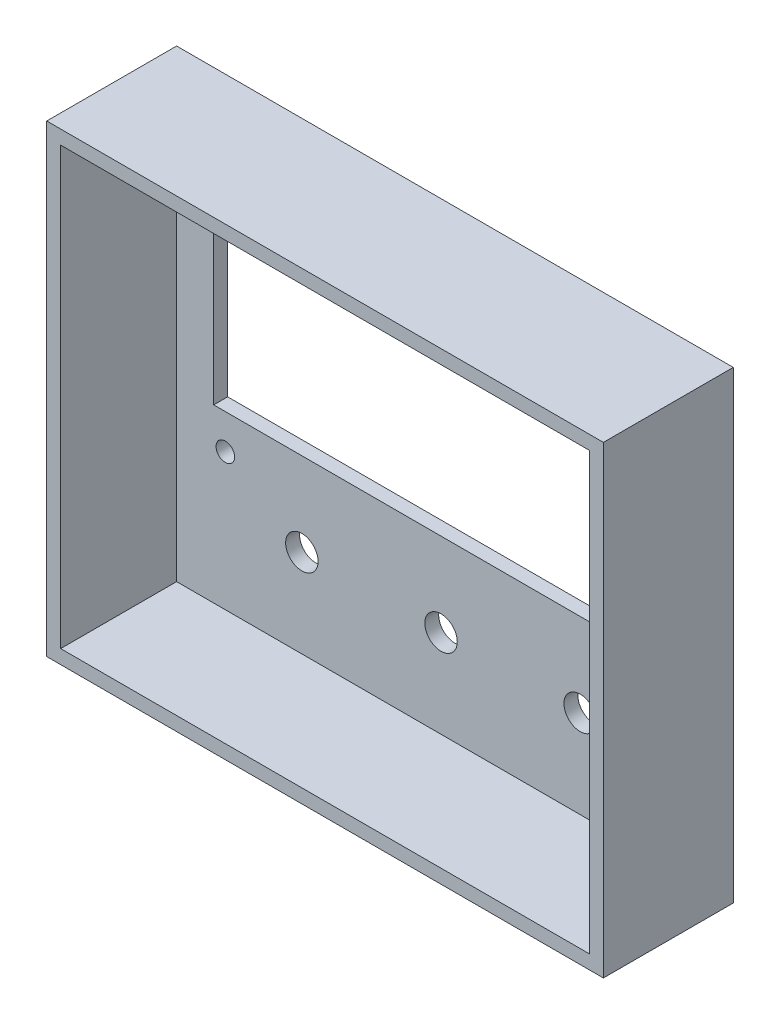
from build123d import *

# Parameters (mm, degrees)
CROQUIS1_W              = 120
CROQUIS1_H              = 100
SALIENTE_EXTRUIR1_DEPTH = 3
CROQUIS2_R              = 2
CROQUIS2_R_2            = 3.5
CORTAR_EXTRUIR1_DEPTH   = 3
CROQUIS3_W              = 120
CROQUIS3_H              = 100
CROQUIS3_W_2            = 114
CROQUIS3_H_2            = 94
SALIENTE_EXTRUIR2_DEPTH = 25


with BuildPart() as part:
    # Croquis1 → Saliente-Extruir1 (new body)
    with BuildSketch(Plane.XY):
        with Locations((60, 50)):
            Rectangle(CROQUIS1_W, CROQUIS1_H)
    extrude(amount=SALIENTE_EXTRUIR1_DEPTH)

    # Croquis2 → Cortar-Extruir1 (cut)
    with BuildSketch(Plane.XY.offset(3)):
        Polygon((11, 80), (11, 60), (11, 40), (109, 40), (109, 80), align=None)
        with Locations((13.5, 87.5)):
            Circle(CROQUIS2_R)
        with Locations((106.5, 87.5)):
            Circle(CROQUIS2_R)
        with Locations((106.5, 32.5)):
            Circle(CROQUIS2_R)
        with Locations((13.5, 32.5)):
            Circle(CROQUIS2_R)
        with Locations((30, 22)):
            Circle(CROQUIS2_R_2)
        with Locations((60, 22)):
            Circle(CROQUIS2_R_2)
        with Locations((90, 22)):
            Circle(CROQUIS2_R_2)
    extrude(amount=-CORTAR_EXTRUIR1_DEPTH, mode=Mode.SUBTRACT)

    # Croquis3 → Saliente-Extruir2 (add)
    with BuildSketch(Plane.XY.offset(3)):
        with Locations((60, 50)):
            Rectangle(CROQUIS3_W, CROQUIS3_H)
        with Locations((60, 50)):
            Rectangle(CROQUIS3_W_2, CROQUIS3_H_2, mode=Mode.SUBTRACT)
    extrude(amount=SALIENTE_EXTRUIR2_DEPTH)


solid = part.part
